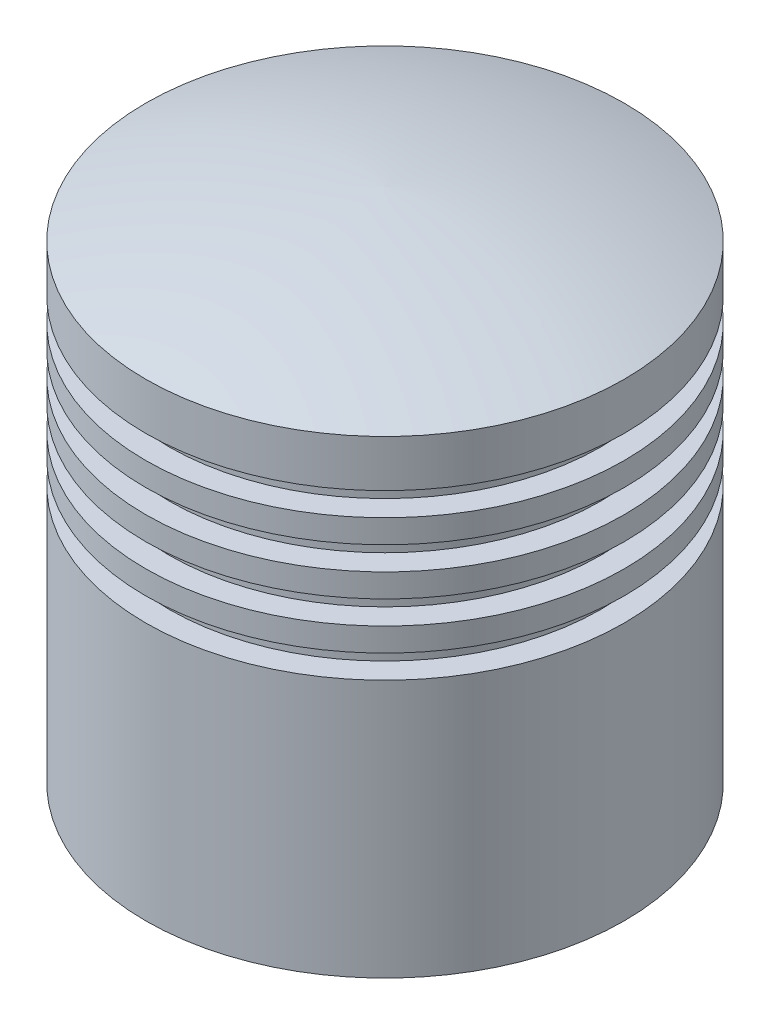
from build123d import *


with BuildPart() as part:
    # Sketch1 → Revolve1 (revolve)
    with BuildSketch(Plane.XY, mode=Mode.PRIVATE) as revolve1_sk:
        with BuildLine():
            Line((43, 0), (43, 30))
            Line((43, 30), (36, 30))
            Line((36, 30), (36, 97.410519767))
            ThreePointArc((36, 97.410519767), (18.156481258, 101.211221355), (0, 102.994107223))
            Line((0, 102.994107223), (0, 110))
            ThreePointArc((0, 110), (25.884399428, 106.960437081), (51, 100))
            Line((51, 100), (51, 90))
            Line((51, 90), (46, 90))
            Line((46, 90), (46, 85))
            Line((46, 85), (51, 85))
            Line((51, 85), (51, 80))
            Line((51, 80), (46, 80))
            Line((46, 80), (46, 75))
            Line((46, 75), (51, 75))
            Line((51, 75), (51, 70))
            Line((51, 70), (46, 70))
            Line((46, 70), (46, 65))
            Line((46, 65), (51, 65))
            Line((51, 65), (51, 60))
            Line((51, 60), (46, 60))
            Line((46, 60), (46, 55))
            Line((46, 55), (51, 55))
            Line((51, 55), (51, 0))
            Line((51, 0), (43, 0))
        make_face()
    revolve(revolve1_sk.sketch.rotate(Axis((0, 0, 0), (0, 1, 0)), 90), axis=Axis((0, 0, 0), (0, 1, 0)))


solid = part.part
